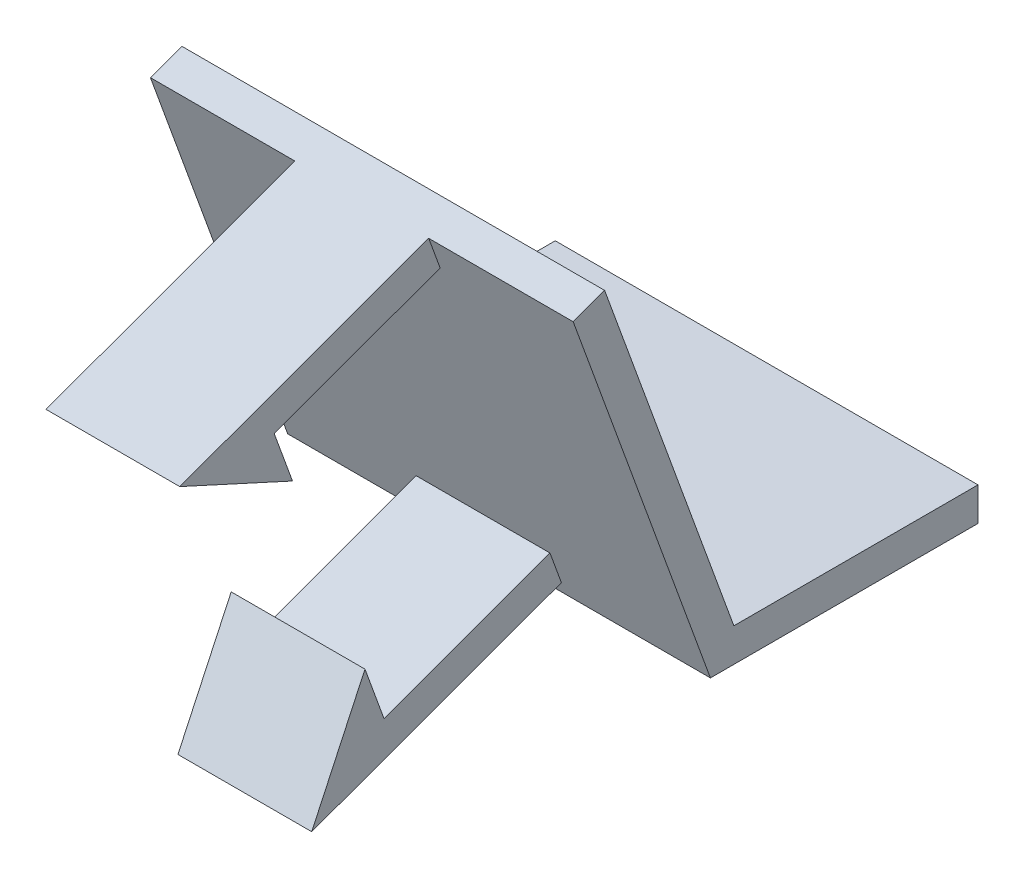
from build123d import *

# Parameters (mm, degrees)
SKETCH2_W           = 40.132
SKETCH2_H           = 25.4
BOSS_EXTRUDE1_DEPTH = 3.175
BOSS_EXTRUDE2_DEPTH = 40.132
SKETCH5_W           = 12.7
SKETCH5_H           = 3.175
BOSS_EXTRUDE3_DEPTH = 16.764
BOSS_EXTRUDE4_DEPTH = 12.7


with BuildPart() as part:
    # Sketch2 → Boss-Extrude1 (new body)
    with BuildSketch(Plane(origin=(0, 0, 0), x_dir=(1, 0, 0), z_dir=(0, 1, 0))):
        with Locations((-38.371824561, 11.620425731)):
            Rectangle(SKETCH2_W, SKETCH2_H)
    extrude(amount=BOSS_EXTRUDE1_DEPTH)

    # Sketch3 → Boss-Extrude2 (add)
    with BuildSketch(Plane(origin=(-18.305824561, 0, 0), x_dir=(0, 0, -1), z_dir=(1, 0, 0))):
        Polygon((-1.079574269, 0), (-14.11054173, 35.802288852), (-11.127017659, 36.888202807), (1.143584665, 3.175), align=None)
    extrude(amount=-BOSS_EXTRUDE2_DEPTH)

    # Sketch5 → Boss-Extrude3 (add)
    with BuildSketch(Plane(origin=(0, -0.346968482, 0.953288069), x_dir=(1, 0, 0), z_dir=(0, -0.34202014332566316, 0.9396926207859104))):
        with Locations((-38.371824561, 36.881736146)):
            Rectangle(SKETCH5_W, SKETCH5_H)
        with Locations((-38.371824561, 3.226736146)):
            Rectangle(SKETCH5_W, SKETCH5_H)
    extrude(amount=BOSS_EXTRUDE3_DEPTH)

    # Sketch6 → Boss-Extrude4 (add)
    with BuildSketch(Plane.ZY.offset(44.721824561)):
        Polygon((29.863548825, 30.068663169), (37.740052372, 27.201850328), (27.040172541, 22.311500585), align=None)
        Polygon((17.266946946, -4.540216054), (20.159821722, 3.407892071), (25.215055071, -7.433090831), align=None)
    extrude(amount=-BOSS_EXTRUDE4_DEPTH)


solid = part.part
